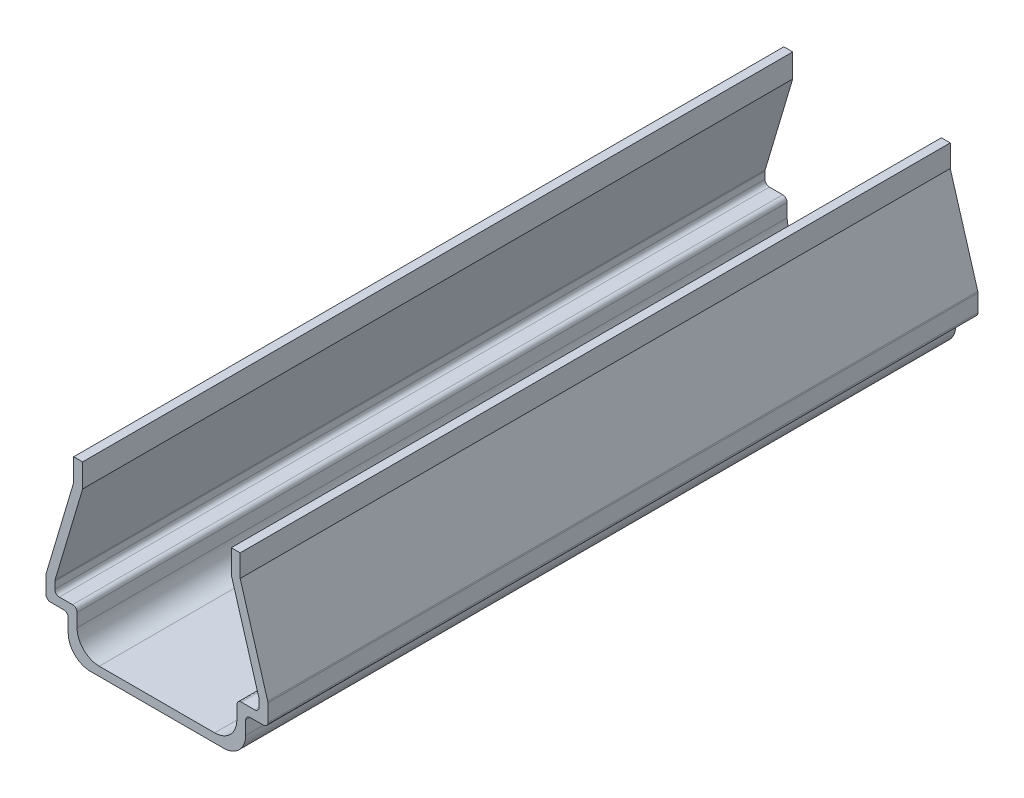
from build123d import *

# Parameters (mm, degrees)
EXTRUDE_THIN1_DEPTH = 32
FILLET1_R           = 1
FILLET2_R           = 0.2


with BuildPart() as part:
    # Sketch1 → Extrude-Thin1 (new body)
    with BuildSketch(Plane.XY):
        Polygon((3.75, 8), (3.75, 7), (5, 2.8), (5, 1.8), (4, 1.8), (4, 0), (-4, 0), (-4, 1.8), (-5, 1.8), (-5, 2.8), (-3.75, 7), (-3.75, 8), (-3.35, 8), (-3.35, 6.941738969), (-4.6, 2.741738969), (-4.6, 2.2), (-3.6, 2.2), (-3.6, 0.4), (3.6, 0.4), (3.6, 2.2), (4.6, 2.2), (4.6, 2.741738969), (3.35, 6.941738969), (3.35, 8), align=None)
    extrude(amount=EXTRUDE_THIN1_DEPTH)

    # Fillet1
    fillet1_edges = [part.edges().sort_by_distance(p)[0] for p in [
        (4, 0, 16),
        (-4, 0, 16),
        (-3.6, 0.4, 16),
        (3.6, 0.4, 16),
    ]]
    fillet(fillet1_edges, radius=FILLET1_R)

    # Fillet2
    fillet2_edges = [part.edges().sort_by_distance(p)[0] for p in [
        (5, 2.8, 16),
        (5, 1.8, 16),
        (4, 1.8, 16),
        (-4, 1.8, 16),
        (-5, 1.8, 16),
        (-5, 2.8, 16),
        (-4.6, 2.741738969, 16),
        (-4.6, 2.2, 16),
        (-3.6, 2.2, 16),
        (3.6, 2.2, 16),
        (4.6, 2.2, 16),
        (4.6, 2.741738969, 16),
    ]]
    fillet(fillet2_edges, radius=FILLET2_R)


solid = part.part
